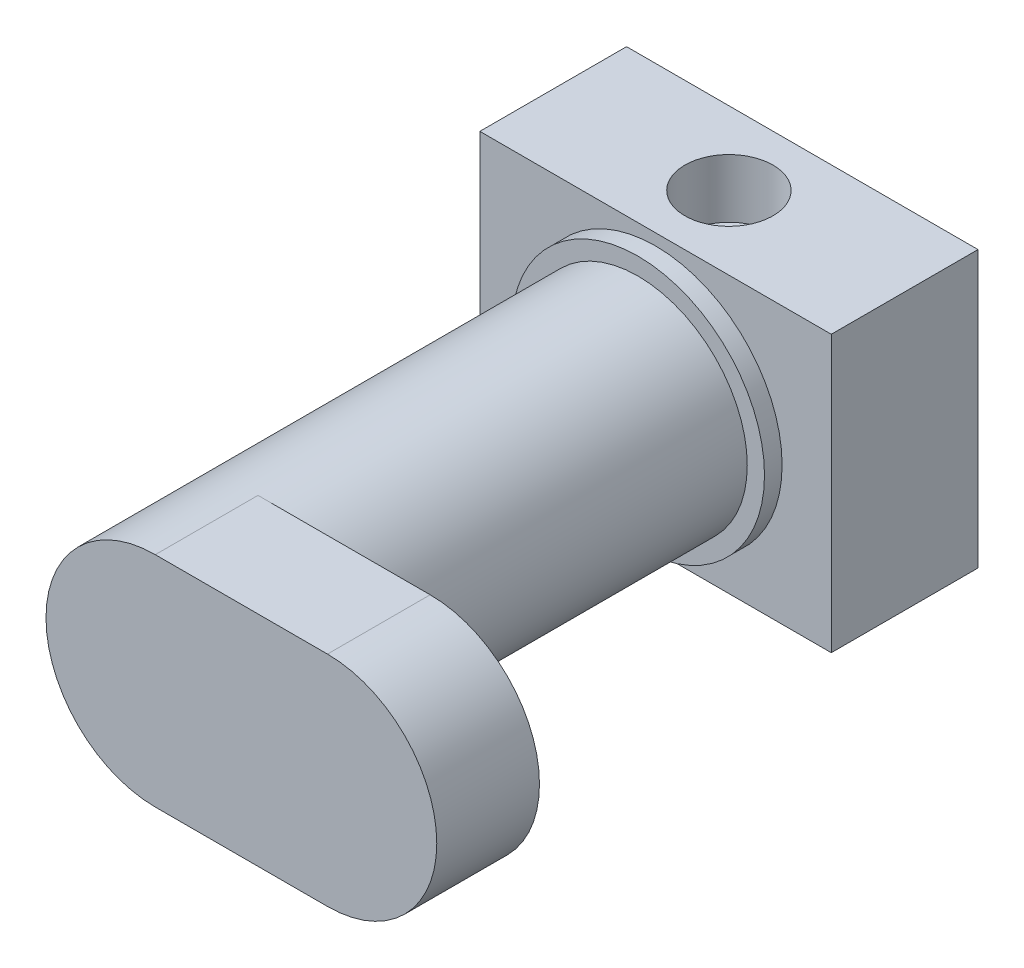
from build123d import *

# Parameters (mm, degrees)
SKETCH2_R           = 17.25
BOSS_EXTRUDE1_DEPTH = 22.4
SKETCH3_R           = 14.9
BOSS_EXTRUDE2_DEPTH = 38.4
SKETCH4_R           = 14.9
BOSS_EXTRUDE3_DEPTH = 13.4
BOSS_EXTRUDE4_DEPTH = 14
SKETCH7_W           = 8
SKETCH7_H           = 12
BOSS_EXTRUDE5_DEPTH = 10
SKETCH9_W           = 3
SKETCH9_H           = 10
CUT_EXTRUDE1_DEPTH  = 2
SKETCH10_W          = 47.910910278
SKETCH10_H          = 37.599432614
BOSS_EXTRUDE6_DEPTH = 20
SKETCH12_R          = 6
CUT_EXTRUDE2_DEPTH  = 8


with BuildPart() as part:
    # Sketch2 → Boss-Extrude1 (new body)
    with BuildSketch(Plane.XY):
        Circle(SKETCH2_R)
    extrude(amount=BOSS_EXTRUDE1_DEPTH)

    # Sketch3 → Boss-Extrude2 (add)
    with BuildSketch(Plane.XY.offset(22.4)):
        Circle(SKETCH3_R)
    extrude(amount=BOSS_EXTRUDE2_DEPTH)

    # Sketch4 → Boss-Extrude3 (add)
    with BuildSketch(Plane.XY.offset(60.8)):
        Circle(SKETCH4_R)
    extrude(amount=BOSS_EXTRUDE3_DEPTH)

    # Sketch6 → Boss-Extrude4 (add)
    with BuildSketch(Plane.XY.offset(74.2)):
        with BuildLine():
            Line((0, 14.9), (23.472492354, 14.9))
            ThreePointArc((23.472492354, 14.9), (38.372492354, 0), (23.472492354, -14.9))
            Line((23.472492354, -14.9), (0, -14.9))
            ThreePointArc((0, -14.9), (-14.9, 0), (0, 14.9))
        make_face()
    extrude(amount=BOSS_EXTRUDE4_DEPTH)

    # Sketch7 → Boss-Extrude5 (add)
    with BuildSketch(Plane(origin=(0, 0, 0), x_dir=(-1, 0, 0), z_dir=(0, 0, -1))):
        Rectangle(SKETCH7_W, SKETCH7_H)
    extrude(amount=BOSS_EXTRUDE5_DEPTH)

    # Sketch9 → Cut-Extrude1 (cut)
    with BuildSketch(Plane(origin=(0, 0, -10), x_dir=(-1, 0, 0), z_dir=(0, 0, -1))):
        Rectangle(SKETCH9_W, SKETCH9_H)
    extrude(amount=-CUT_EXTRUDE1_DEPTH, mode=Mode.SUBTRACT)

    # Sketch10 → Boss-Extrude6 (add)
    with BuildSketch(Plane(origin=(0, 0, 0), x_dir=(-1, 0, 0), z_dir=(0, 0, -1))):
        Rectangle(SKETCH10_W, SKETCH10_H)
    extrude(amount=-BOSS_EXTRUDE6_DEPTH)

    # Sketch12 → Cut-Extrude2 (cut)
    with BuildSketch(Plane.XZ.offset(18.799716307)):
        with Locations(Location((0, 10, 0), (0, 0, 270))):
            Circle(SKETCH12_R)
    cut_extrude2 = extrude(amount=-CUT_EXTRUDE2_DEPTH, mode=Mode.SUBTRACT)

    # Mirror1: Cut-Extrude2 across plane
    add(cut_extrude2.mirror(Plane(origin=(0, 0, 0), x_dir=(0, 0, 1), z_dir=(0, -1, 0))), mode=Mode.SUBTRACT)


solid = part.part
